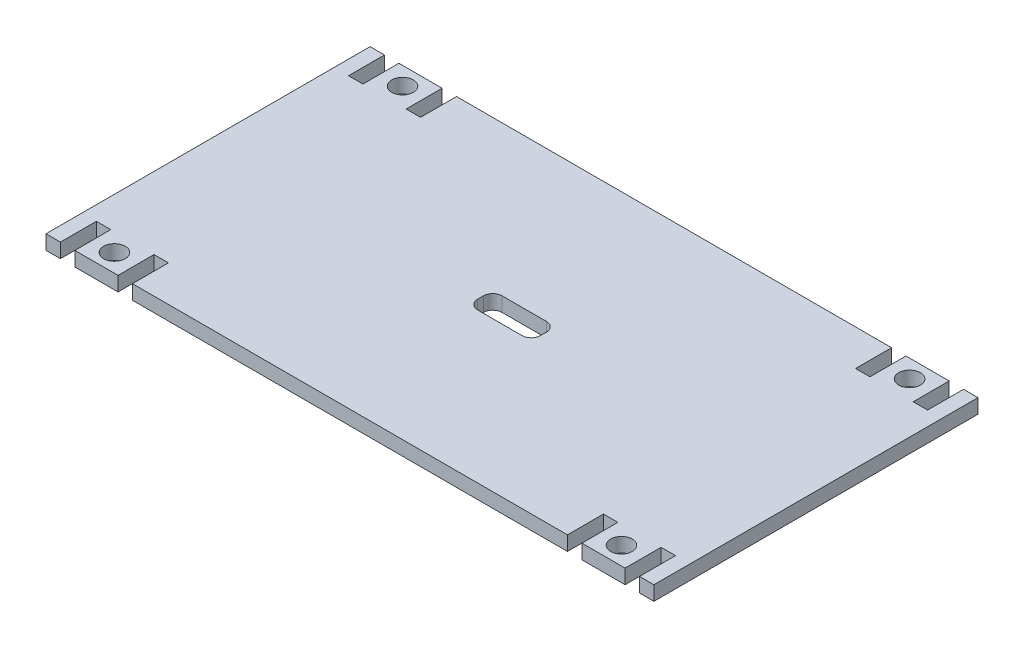
from build123d import *

# Parameters (mm, degrees)
SKETCH1_R           = 1.5
BOSS_EXTRUDE1_DEPTH = 2
SKETCH2_W           = 8.75
SKETCH2_H           = 3.4
CUT_EXTRUDE1_DEPTH  = 10
FILLET1_R           = 1.3


with BuildPart() as part:
    # Sketch1 → Boss-Extrude1 (new body)
    with BuildSketch(Plane(origin=(0, 0, 0), x_dir=(1, 0, 0), z_dir=(0, 1, 0))):
        Polygon((0, 0), (2, 0), (2, 5), (4, 5), (4, 0), (10, 0), (10, 5), (12, 5), (12, 0), (72.4, 0), (72.4, 5), (74.4, 5), (74.4, 0), (80.4, 0), (80.4, 5), (82.4, 5), (82.4, 0), (84.4, 0), (84.4, 45), (82.4, 45), (82.4, 40), (80.4, 40), (80.4, 45), (74.4, 45), (74.4, 40), (72.4, 40), (72.4, 45), (12, 45), (12, 40), (10, 40), (10, 45), (4, 45), (4, 40), (2, 40), (2, 45), (0, 45), align=None)
        with Locations(Location((7, 42.5, 0), (0, 0, 270))):
            Circle(SKETCH1_R, mode=Mode.SUBTRACT)
        with Locations(Location((77.4, 42.5, 0), (0, 0, 90))):
            Circle(SKETCH1_R, mode=Mode.SUBTRACT)
        with Locations(Location((7, 2.5, 0), (0, 0, 90))):
            Circle(SKETCH1_R, mode=Mode.SUBTRACT)
        with Locations(Location((77.4, 2.5, 0), (0, 0, 270))):
            Circle(SKETCH1_R, mode=Mode.SUBTRACT)
    extrude(amount=BOSS_EXTRUDE1_DEPTH)

    # Sketch2 → Cut-Extrude1 (cut)
    with BuildSketch(Plane(origin=(0, 2, 0), x_dir=(1, 0, 0), z_dir=(0, 1, 0))):
        with Locations((42.2, 22.5)):
            Rectangle(SKETCH2_W, SKETCH2_H)
    extrude(amount=-CUT_EXTRUDE1_DEPTH, mode=Mode.SUBTRACT)

    # Fillet1
    fillet1_edges = [part.edges().sort_by_distance(p)[0] for p in [
        (46.575, 1, -24.2),
        (46.575, 1, -20.8),
        (37.825, 1, -20.8),
        (37.825, 1, -24.2),
    ]]
    fillet(fillet1_edges, radius=FILLET1_R)


solid = part.part
